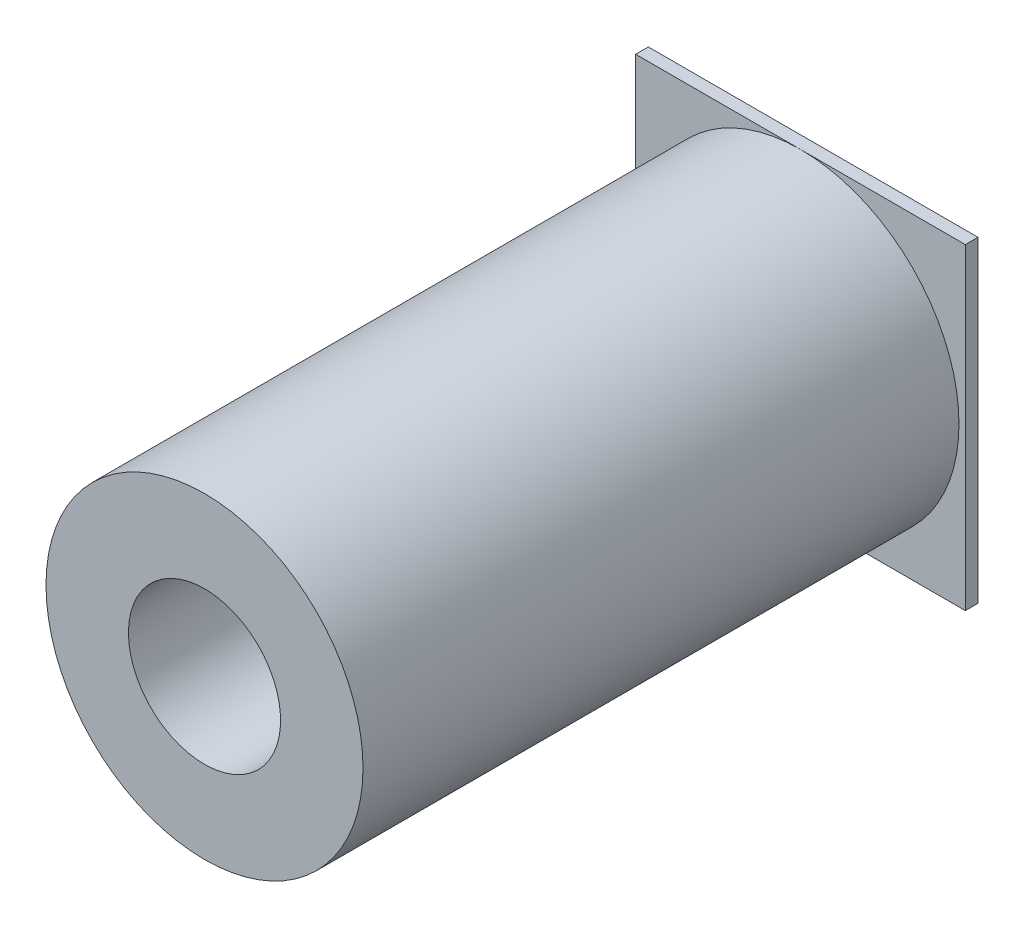
from build123d import *

# Parameters (mm, degrees)
SKETCH1_W           = 26
SKETCH1_H           = 25
BOSS_EXTRUDE1_DEPTH = 1
SKETCH2_R           = 12.5
BOSS_EXTRUDE2_DEPTH = 47
SKETCH3_R           = 6
CUT_EXTRUDE1_DEPTH  = 52.276212809


with BuildPart() as part:
    # Sketch1 → Boss-Extrude1 (new body)
    with BuildSketch(Plane.XY):
        Rectangle(SKETCH1_W, SKETCH1_H)
    extrude(amount=BOSS_EXTRUDE1_DEPTH)

    # Sketch2 → Boss-Extrude2 (add)
    with BuildSketch(Plane.XY.offset(1)):
        with Locations(Location((0, 0, 0), (0, 0, 270))):
            Circle(SKETCH2_R)
    extrude(amount=BOSS_EXTRUDE2_DEPTH)

    # Sketch3 → Cut-Extrude1 (cut, through all)
    with BuildSketch(Plane(origin=(0, 0, 0), x_dir=(-1, 0, 0), z_dir=(0, 0, -1))):
        Circle(SKETCH3_R)
    extrude(amount=-CUT_EXTRUDE1_DEPTH, mode=Mode.SUBTRACT)


solid = part.part
